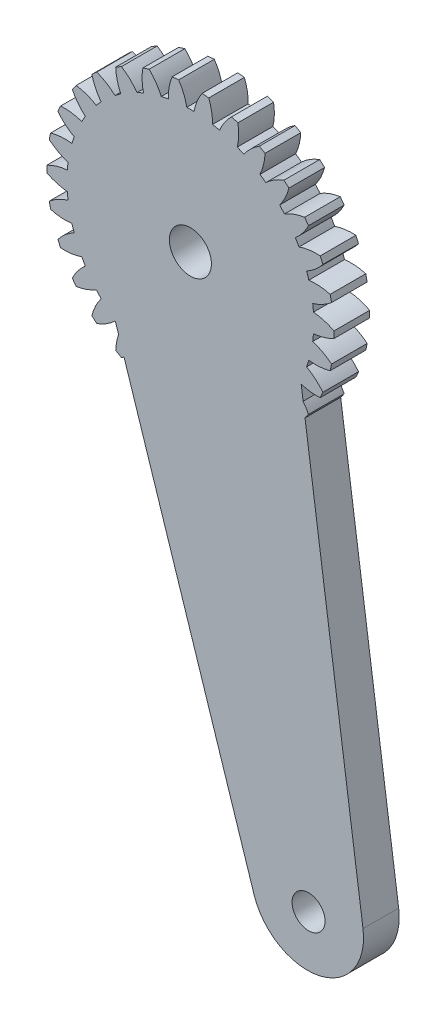
from build123d import *

# Parameters (mm, degrees)
SKETCH1_R           = 12.8
BOSS_EXTRUDE1_DEPTH = 3.18
CUT_EXTRUDE1_DEPTH  = 19.379129468
CIRPATTERN1_COUNT   = 30
SKETCH4_R           = 1.875
CUT_EXTRUDE3_DEPTH  = 19.349437359
BOSS_EXTRUDE2_START = -3.18
BOSS_EXTRUDE2_DEPTH = 3.18
SKETCH7_R           = 1.47
CUT_EXTRUDE4_DEPTH  = 53.659533455


with BuildPart() as part:
    # Sketch1 → Boss-Extrude1 (new body)
    with BuildSketch(Plane.XY):
        with Locations(Location((0, 0, 0), (0, 0, 180))):
            Circle(SKETCH1_R)
    extrude(amount=BOSS_EXTRUDE1_DEPTH)

    # Sketch2 → Cut-Extrude1 (cut, through all)
    with BuildSketch(Plane.XY.offset(3.18)):
        with BuildLine():
            ThreePointArc((-0.321034752, 10.995314306), (0, 11), (0.321034752, 10.995314306))
            ThreePointArc((0.321034752, 10.995314306), (0.594388904, 11.912556329), (1.044293354, 12.75732932))
            ThreePointArc((1.044293354, 12.75732932), (0, 12.8), (-1.044293354, 12.75732932))
            ThreePointArc((-1.044293354, 12.75732932), (-0.594388904, 11.912556329), (-0.321034752, 10.995314306))
        make_face()
    cut_extrude1 = extrude(amount=-CUT_EXTRUDE1_DEPTH, mode=Mode.SUBTRACT)

    # CirPattern1: Cut-Extrude1 ×30 about axis
    cirpattern1_axis = Axis((0, 0, 0), (0, 0, 1))
    for i in range(1, CIRPATTERN1_COUNT):
        add(cut_extrude1.rotate(cirpattern1_axis, i * 360 / CIRPATTERN1_COUNT), mode=Mode.SUBTRACT)

    # Sketch4 → Cut-Extrude3 (cut, through all)
    with BuildSketch(Plane(origin=(0, 0, 0), x_dir=(-1, 0, 0), z_dir=(0, 0, -1))):
        Circle(SKETCH4_R)
    extrude(amount=-CUT_EXTRUDE3_DEPTH, mode=Mode.SUBTRACT)

    # Sketch6 → Boss-Extrude2 (add)
    with BuildSketch(Plane(origin=(0, 0, 0), x_dir=(-1, 0, 0), z_dir=(0, 0, -1)).offset(BOSS_EXTRUDE2_START)):
        with BuildLine():
            Line((-9.828614264, -4.939467749), (-15.386321044, -44.551484806))
            ThreePointArc((-15.386321044, -44.551484806), (-11.558440512, -50.118310067), (-5.67917693, -46.790176566))
            Line((-5.67917693, -46.790176566), (6.672650371, -8.74504071))
            ThreePointArc((6.672650371, -8.74504071), (-2.471967519, -10.71864621), (-9.828614264, -4.939467749))
        make_face()
    extrude(amount=BOSS_EXTRUDE2_DEPTH)

    # Sketch7 → Cut-Extrude4 (cut, through all)
    with BuildSketch(Plane.XY.offset(3.18)):
        with Locations((10.532748987, -45.670830686)):
            Circle(SKETCH7_R)
    extrude(amount=-CUT_EXTRUDE4_DEPTH, mode=Mode.SUBTRACT)


solid = part.part
